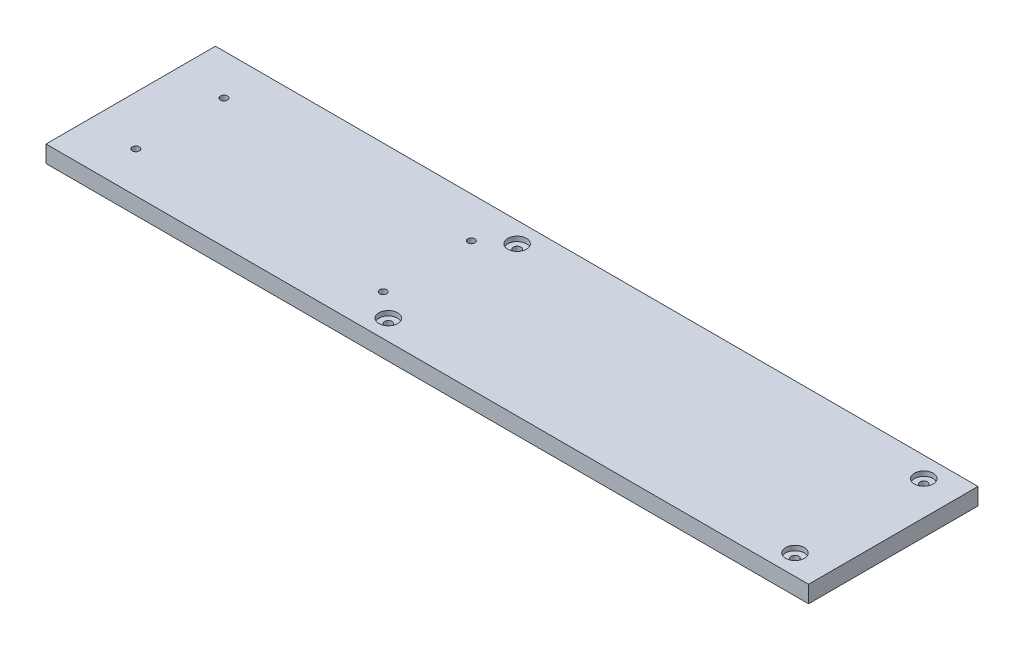
from build123d import *

# Parameters (mm, degrees)
SKETCH1_W                                    = 450
SKETCH1_H                                    = 100
BOSS_EXTRUDE1_DEPTH                          = 10
CBORE_FOR_M4_HEX_HEAD_CAP_SCREW1_D           = 4.5
CBORE_FOR_M4_HEX_HEAD_CAP_SCREW1_CBORE_D     = 11.083
CBORE_FOR_M4_HEX_HEAD_CAP_SCREW1_CBORE_DEPTH = 2.8
M5_TAPPED_HOLE1_D                            = 4.2


with BuildPart() as part:
    # Sketch1 → Boss-Extrude1 (new body)
    with BuildSketch(Plane(origin=(0, 0, 0), x_dir=(1, 0, 0), z_dir=(0, 1, 0))):
        Rectangle(SKETCH1_W, SKETCH1_H)
    extrude(amount=BOSS_EXTRUDE1_DEPTH)

    # CBORE for M4 Hex Head Cap Screw1 (through all)
    with Locations(Plane(origin=(0, 10, 0), x_dir=(1, 0, 0), z_dir=(0, 1, 0))):
        with Locations((205, -38), (205, 38), (-35, 38), (-35, -38)):
            CounterBoreHole(CBORE_FOR_M4_HEX_HEAD_CAP_SCREW1_D / 2, CBORE_FOR_M4_HEX_HEAD_CAP_SCREW1_CBORE_D / 2, CBORE_FOR_M4_HEX_HEAD_CAP_SCREW1_CBORE_DEPTH)

    # M5 Tapped Hole1 (through all)
    with Locations(Plane(origin=(0, 10, 0), x_dir=(1, 0, 0), z_dir=(0, 1, 0))):
        with Locations((-50, 26), (-50, -26), (-196, -26), (-196, 26)):
            Hole(M5_TAPPED_HOLE1_D / 2)


solid = part.part
